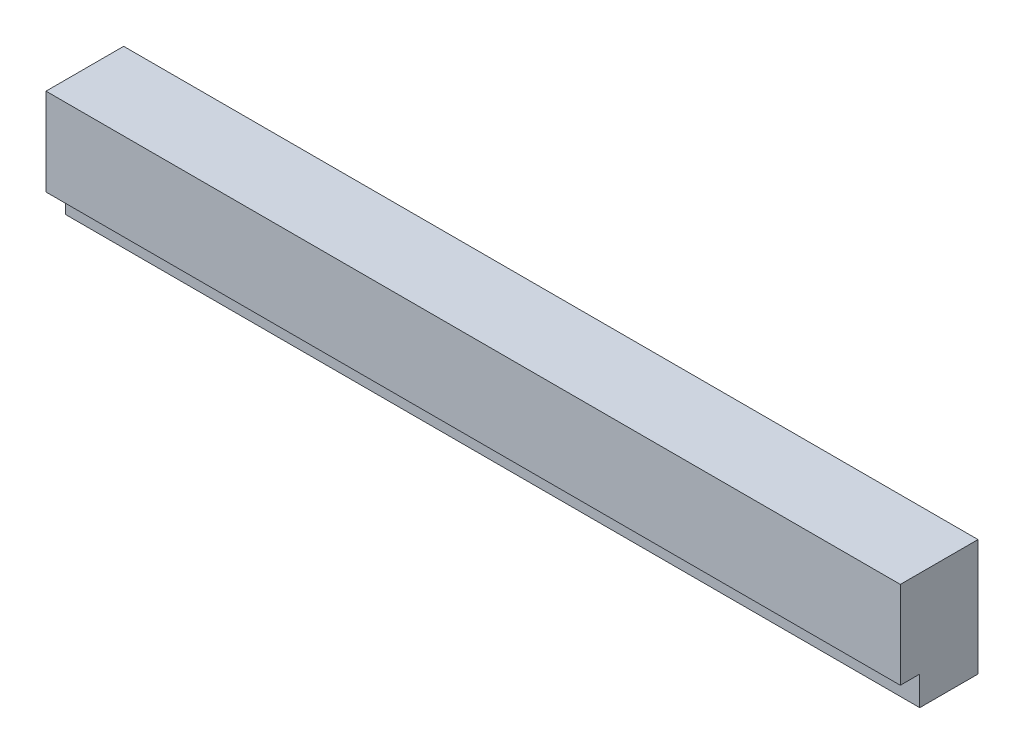
from build123d import *

# Parameters (mm, degrees)
SKETCH1_W           = 880
SKETCH1_H           = 80
BOSS_EXTRUDE1_DEPTH = 120
SKETCH2_W           = 20
SKETCH2_H           = 30
CUT_EXTRUDE1_DEPTH  = 1067


with BuildPart() as part:
    # Sketch1 → Boss-Extrude1 (new body)
    with BuildSketch(Plane(origin=(0, 0, 0), x_dir=(1, 0, 0), z_dir=(0, 1, 0))):
        Rectangle(SKETCH1_W, SKETCH1_H)
    extrude(amount=BOSS_EXTRUDE1_DEPTH)

    # Sketch2 → Cut-Extrude1 (cut)
    with BuildSketch(Plane(origin=(440, 0, 0), x_dir=(0, 0, -1), z_dir=(1, 0, 0))):
        with Locations((-30, 15)):
            Rectangle(SKETCH2_W, SKETCH2_H)
    extrude(amount=-CUT_EXTRUDE1_DEPTH, mode=Mode.SUBTRACT)


solid = part.part
